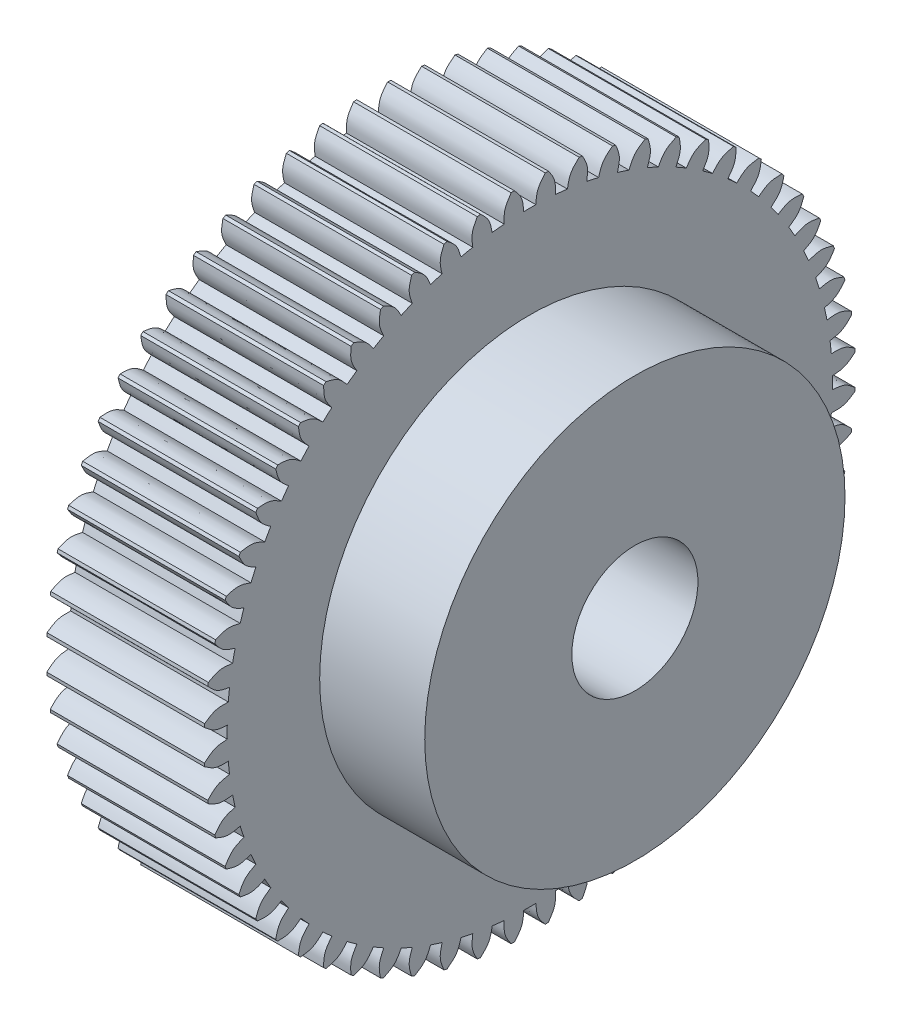
from build123d import *

# Parameters (mm, degrees)
KUGGLUCKA_DEPTH  = 15
CIRPATTERN_COUNT = 60


with BuildPart() as part:
    # Ritning 1 → Kugghjulsämne (revolve)
    with BuildSketch(Plane.XY, mode=Mode.PRIVATE) as kugghjuls_mne_sk:
        Polygon((-12.5, -9.5), (12.5, -9.5), (12.5, 4.5), (2.5, 4.5), (2.5, 15.5), (-12.5, 15.5), align=None)
    revolve(kugghjuls_mne_sk.sketch.rotate(Axis((-12.5, -15.5, 0), (1, 0, 0)), 90), axis=Axis((-12.5, -15.5, 0), (1, 0, 0)))

    # Ritning 2 → Kugglucka (cut)
    with BuildSketch(Plane.ZY.offset(12.5)):
        with BuildLine():
            Line((1.468439282, 15.465201212), (0, 16.933640493))
            Line((0, 16.933640493), (-1.468439282, 15.465201212))
            add(Edge.make_bspline(
                [(-1.468439282, 15.465201212), (-1.201451518, 15.156321595), (-0.662309062, 14.532584713), (-0.604027899, 13.709668563), (-0.574608045, 13.294267235)],
                knots=[0, 0, 0, 0, 0.495208197, 1, 1, 1, 1], degree=3))
            ThreePointArc((-0.574608045, 13.294267235), (0, 13.3), (0.574608045, 13.294267235))
            add(Edge.make_bspline(
                [(1.468439282, 15.465201212), (1.201451518, 15.156321595), (0.662309062, 14.532584713), (0.604027899, 13.709668563), (0.574608045, 13.294267235)],
                knots=[0, 0, 0, 0, 0.495208197, 1, 1, 1, 1], degree=3))
        make_face()
    kugglucka = extrude(amount=-KUGGLUCKA_DEPTH, mode=Mode.SUBTRACT)

    # CirPattern: Kugglucka ×60 about axis
    cirpattern_axis = Axis((-12.5, -15.5, 0), (-1, 0, 0))
    for i in range(1, CIRPATTERN_COUNT):
        add(kugglucka.rotate(cirpattern_axis, i * 360 / CIRPATTERN_COUNT), mode=Mode.SUBTRACT)


solid = part.part
